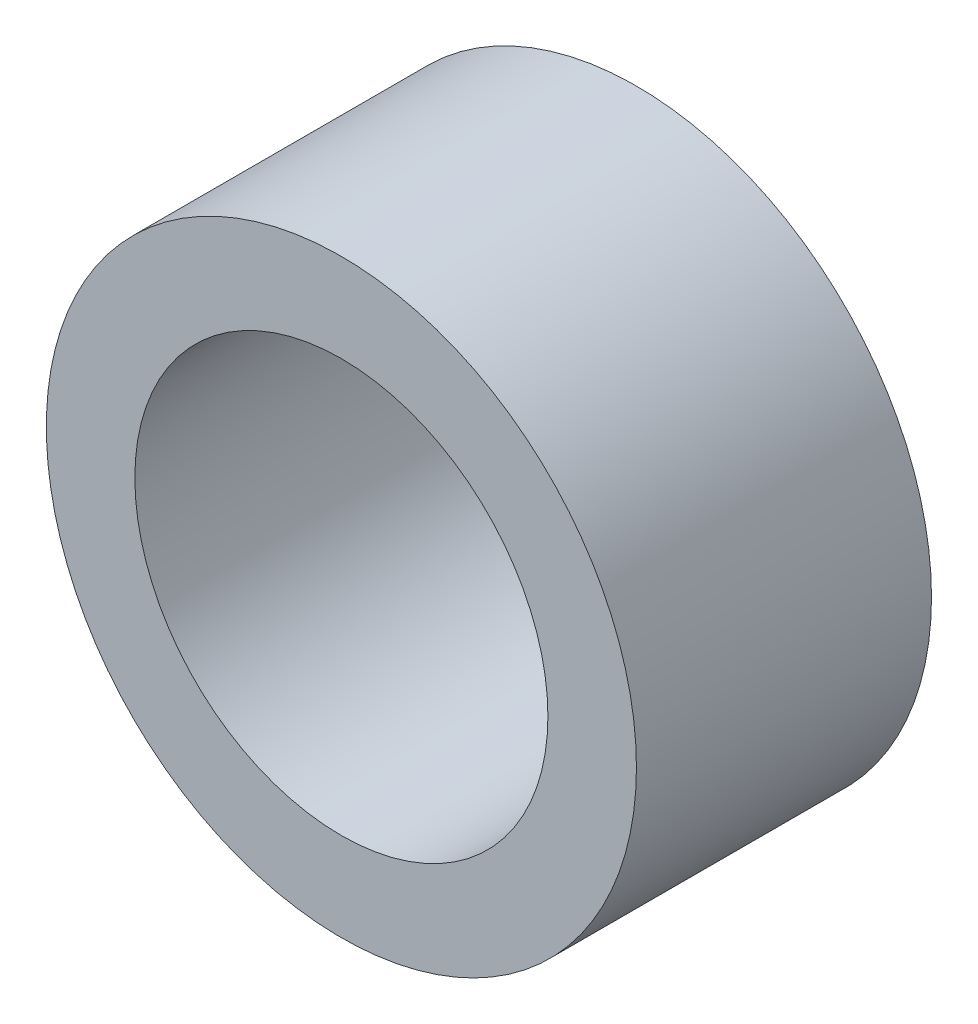
from build123d import *

# Parameters (mm, degrees)
SKETCH_1_R      = 3
SKETCH_1_R_2    = 2.1
EXTRUDE_1_DEPTH = 3


with BuildPart() as part:
    # 草图1 → 凸台-拉伸1 (new body)
    with BuildSketch(Plane.XY):
        Circle(SKETCH_1_R)
        Circle(SKETCH_1_R_2, mode=Mode.SUBTRACT)
    extrude(amount=EXTRUDE_1_DEPTH)


solid = part.part
